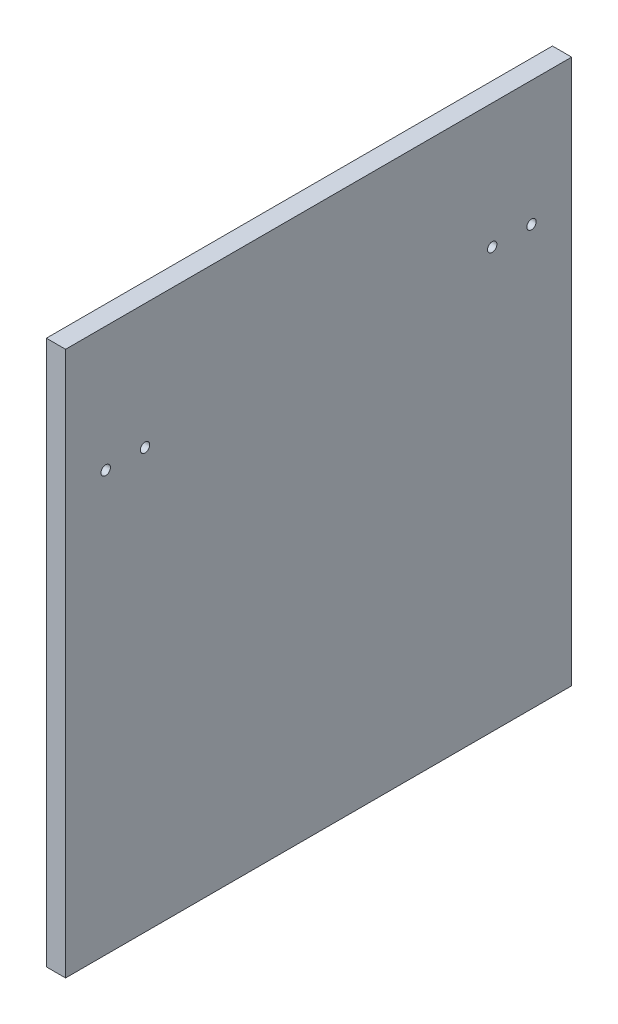
from build123d import *

# Parameters (mm, degrees)
SKETCH1_W           = 167.3
SKETCH1_H           = 180
BOSS_EXTRUDE1_DEPTH = 6.35
SKETCH2_R           = 1.55
CUT_EXTRUDE1_DEPTH  = 124.035137258


with BuildPart() as part:
    # Sketch1 → Boss-Extrude1 (new body)
    with BuildSketch(Plane(origin=(0, 0, 0), x_dir=(0, 0, -1), z_dir=(1, 0, 0))):
        Rectangle(SKETCH1_W, SKETCH1_H)
    extrude(amount=BOSS_EXTRUDE1_DEPTH)

    # Sketch2 → Cut-Extrude1 (cut, through all)
    with BuildSketch(Plane.ZY):
        with Locations((57.387313546, 48.749672268)):
            Circle(SKETCH2_R)
        with Locations((70.377953582, 48.749672268)):
            Circle(SKETCH2_R)
        with Locations((-57.387880988, 48.749672268)):
            Circle(SKETCH2_R)
        with Locations((-70.377953582, 48.749672268)):
            Circle(SKETCH2_R)
    extrude(amount=-CUT_EXTRUDE1_DEPTH, mode=Mode.SUBTRACT)


solid = part.part
